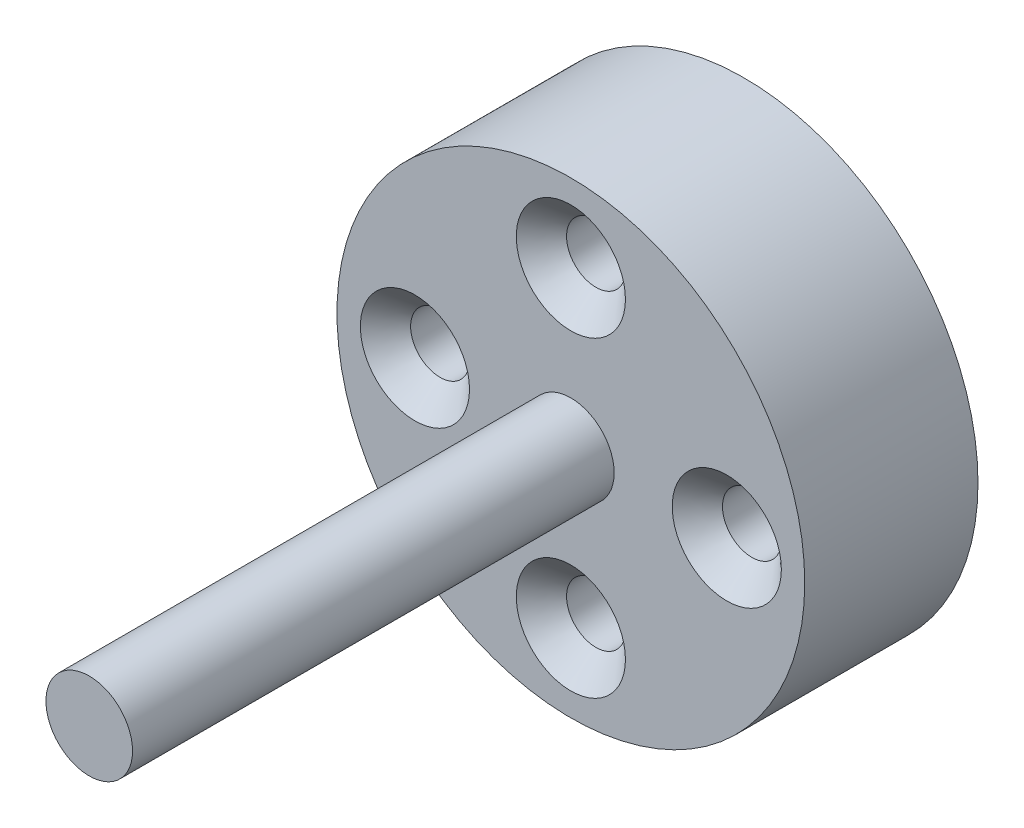
from build123d import *

# Parameters (mm, degrees)
SKETCH1_R                                       = 13.5
SKETCH1_R_2                                     = 1.6
BOSS_EXTRUDE1_DEPTH                             = 10
SKETCH2_R                                       = 2.5
BOSS_EXTRUDE2_DEPTH                             = 27.8
SKETCH3_R                                       = 2.3
CUT_EXTRUDE1_DEPTH                              = 6
CSK_FOR_M3_FLAT_HEAD_MACHINE_SCREW1_D           = 3.4
CSK_FOR_M3_FLAT_HEAD_MACHINE_SCREW1_CSINK_D     = 6.3
CSK_FOR_M3_FLAT_HEAD_MACHINE_SCREW1_CSINK_ANGLE = 90


with BuildPart() as part:
    # Sketch1 → Boss-Extrude1 (new body)
    with BuildSketch(Plane.XY):
        Circle(SKETCH1_R)
        with Locations((0, 9)):
            Circle(SKETCH1_R_2, mode=Mode.SUBTRACT)
        with Locations((0, -9)):
            Circle(SKETCH1_R_2, mode=Mode.SUBTRACT)
        with Locations((-9, 0)):
            Circle(SKETCH1_R_2, mode=Mode.SUBTRACT)
        with Locations((9, 0)):
            Circle(SKETCH1_R_2, mode=Mode.SUBTRACT)
    extrude(amount=BOSS_EXTRUDE1_DEPTH)

    # Sketch2 → Boss-Extrude2 (add)
    with BuildSketch(Plane.XY.offset(10)):
        Circle(SKETCH2_R)
    extrude(amount=BOSS_EXTRUDE2_DEPTH)

    # Sketch3 → Cut-Extrude1 (cut)
    with BuildSketch(Plane(origin=(0, 0, 0), x_dir=(-1, 0, 0), z_dir=(0, 0, -1))):
        Circle(SKETCH3_R)
    extrude(amount=-CUT_EXTRUDE1_DEPTH, mode=Mode.SUBTRACT)

    # CSK for M3 Flat Head Machine Screw1 (through all)
    with Locations(Plane.XY.offset(10)):
        with Locations((0, 9), (9, 0), (-9, 0), (0, -9)):
            CounterSinkHole(CSK_FOR_M3_FLAT_HEAD_MACHINE_SCREW1_D / 2, CSK_FOR_M3_FLAT_HEAD_MACHINE_SCREW1_CSINK_D / 2, counter_sink_angle=CSK_FOR_M3_FLAT_HEAD_MACHINE_SCREW1_CSINK_ANGLE)


solid = part.part
